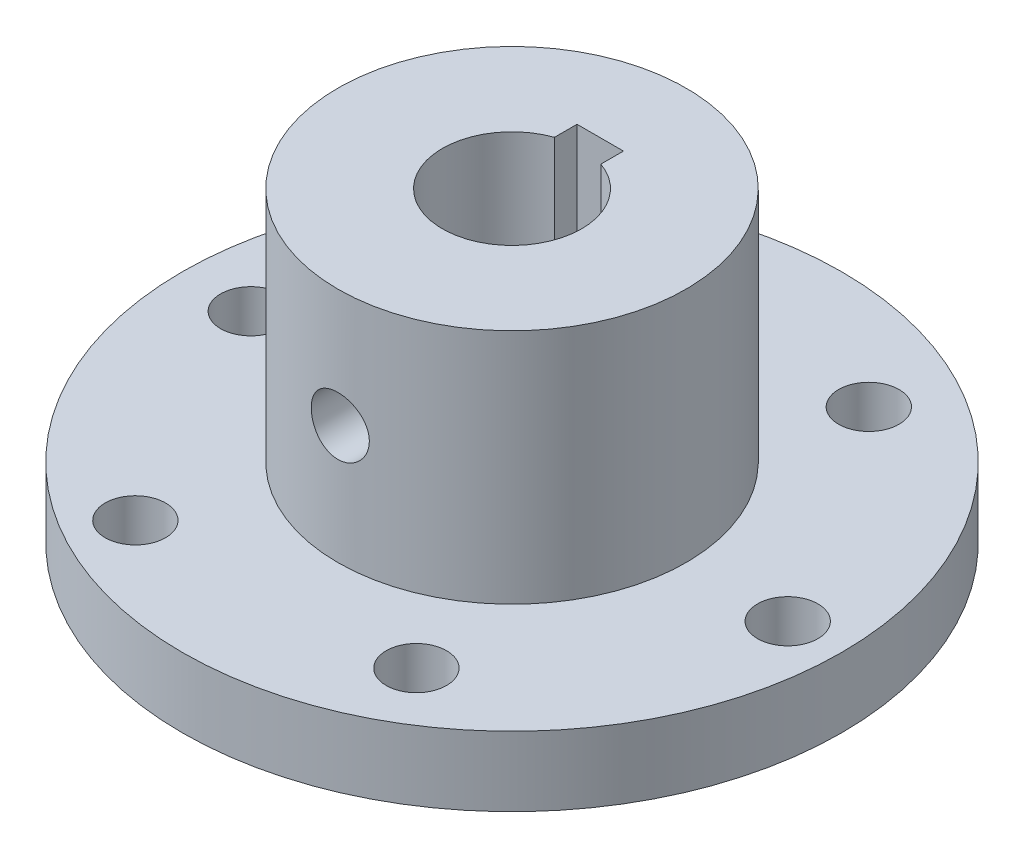
from build123d import *

# Parameters (mm, degrees)
CUT_EXTRUDE2_REACH     = 47.048
SKETCH3_R              = 2.6
CUT_EXTRUDE3_REACH     = 50.063
M6_TAPPED_HOLE2_REACH  = 56.337
M6_TAPPED_HOLE2_BORE_R = 2.5


with BuildPart() as part:
    # Sketch1 → Revolve1 (revolve)
    with BuildSketch(Plane(origin=(0, 0, 0), x_dir=(0, 0, -1), z_dir=(1, 0, 0)), mode=Mode.PRIVATE) as revolve1_sk:
        Polygon((6, 0), (28.4, 0), (28.4, 6), (15, 6), (15, 26.4), (6, 26.4), align=None)
    revolve(revolve1_sk.sketch.rotate(Axis((0, 21.767139862, 0), (0, -1, 0)), 180), axis=Axis((0, 21.767139862, 0), (0, -1, 0)))

    # Sketch3 → Cut-Extrude2 (cut, up to next)
    with BuildSketch(Plane(origin=(0, 6, 0), x_dir=(1, 0, 0), z_dir=(0, 1, 0)), mode=Mode.PRIVATE) as cut_extrude2_sk1:
        with Locations(Location((-22.5, 0, 0), (0, 0, 270))):
            Circle(SKETCH3_R)
    cut_extrude2_tool1 = extrude(cut_extrude2_sk1.sketch, amount=-CUT_EXTRUDE2_REACH, mode=Mode.PRIVATE) & part.part
    # Sketch3 → Cut-Extrude2 (cut, up to next)
    with BuildSketch(Plane(origin=(0, 6, 0), x_dir=(1, 0, 0), z_dir=(0, 1, 0)), mode=Mode.PRIVATE) as cut_extrude2_sk2:
        with Locations(Location((11.25, 19.485571585, 0), (0, 0, 270))):
            Circle(SKETCH3_R)
    cut_extrude2_tool2 = extrude(cut_extrude2_sk2.sketch, amount=-CUT_EXTRUDE2_REACH, mode=Mode.PRIVATE) & part.part
    # Sketch3 → Cut-Extrude2 (cut, up to next)
    with BuildSketch(Plane(origin=(0, 6, 0), x_dir=(1, 0, 0), z_dir=(0, 1, 0)), mode=Mode.PRIVATE) as cut_extrude2_sk3:
        with Locations(Location((11.25, -19.485571585, 0), (0, 0, 270))):
            Circle(SKETCH3_R)
    cut_extrude2_tool3 = extrude(cut_extrude2_sk3.sketch, amount=-CUT_EXTRUDE2_REACH, mode=Mode.PRIVATE) & part.part
    # Sketch3 → Cut-Extrude2 (cut, up to next)
    with BuildSketch(Plane(origin=(0, 6, 0), x_dir=(1, 0, 0), z_dir=(0, 1, 0)), mode=Mode.PRIVATE) as cut_extrude2_sk4:
        with Locations(Location((23.75, 0, 0), (0, 0, 270))):
            Circle(SKETCH3_R)
    cut_extrude2_tool4 = extrude(cut_extrude2_sk4.sketch, amount=-CUT_EXTRUDE2_REACH, mode=Mode.PRIVATE) & part.part
    # Sketch3 → Cut-Extrude2 (cut, up to next)
    with BuildSketch(Plane(origin=(0, 6, 0), x_dir=(1, 0, 0), z_dir=(0, 1, 0)), mode=Mode.PRIVATE) as cut_extrude2_sk5:
        with Locations(Location((-11.875, -20.56810334, 0), (0, 0, 270))):
            Circle(SKETCH3_R)
    cut_extrude2_tool5 = extrude(cut_extrude2_sk5.sketch, amount=-CUT_EXTRUDE2_REACH, mode=Mode.PRIVATE) & part.part
    # Sketch3 → Cut-Extrude2 (cut, up to next)
    with BuildSketch(Plane(origin=(0, 6, 0), x_dir=(1, 0, 0), z_dir=(0, 1, 0)), mode=Mode.PRIVATE) as cut_extrude2_sk6:
        with Locations(Location((-11.875, 20.56810334, 0), (0, 0, 270))):
            Circle(SKETCH3_R)
    cut_extrude2_tool6 = extrude(cut_extrude2_sk6.sketch, amount=-CUT_EXTRUDE2_REACH, mode=Mode.PRIVATE) & part.part
    add(cut_extrude2_tool1.solids().sort_by_distance((-22.5, 6, 0))[0], mode=Mode.SUBTRACT)
    add(cut_extrude2_tool2.solids().sort_by_distance((11.25, 6, -19.485572))[0], mode=Mode.SUBTRACT)
    add(cut_extrude2_tool3.solids().sort_by_distance((11.25, 6, 19.485572))[0], mode=Mode.SUBTRACT)
    add(cut_extrude2_tool4.solids().sort_by_distance((23.75, 6, 0))[0], mode=Mode.SUBTRACT)
    add(cut_extrude2_tool5.solids().sort_by_distance((-11.875, 6, 20.568103))[0], mode=Mode.SUBTRACT)
    add(cut_extrude2_tool6.solids().sort_by_distance((-11.875, 6, -20.568103))[0], mode=Mode.SUBTRACT)

    # Sketch4 → Cut-Extrude3 (cut, up to next)
    with BuildSketch(Plane(origin=(0, 26.4, 0), x_dir=(1, 0, 0), z_dir=(0, 1, 0)), mode=Mode.PRIVATE) as cut_extrude3_sk1:
        with BuildLine():
            Line((-2, 7.6), (-2, 5.656854249))
            ThreePointArc((-2, 5.656854249), (0, 6), (2, 5.656854249))
            Line((2, 5.656854249), (2, 7.6))
            Line((2, 7.6), (-2, 7.6))
        make_face()
    cut_extrude3_tool1 = extrude(cut_extrude3_sk1.sketch, amount=-CUT_EXTRUDE3_REACH, mode=Mode.PRIVATE) & part.part
    add(cut_extrude3_tool1.solids().sort_by_distance((0, 26.4, -6.740451))[0], mode=Mode.SUBTRACT)

    # M6 Tapped Hole2 bore (on position points) → M6 Tapped Hole2 (cut, up to next)
    with BuildSketch(Plane(origin=(0, 16.2, 15), x_dir=(1, 0, 0), z_dir=(0, 0, 1)), mode=Mode.PRIVATE) as m6_tapped_hole2_sk1:
        Circle(M6_TAPPED_HOLE2_BORE_R)
    m6_tapped_hole2_tool1 = extrude(m6_tapped_hole2_sk1.sketch, amount=-M6_TAPPED_HOLE2_REACH, mode=Mode.PRIVATE) & part.part
    add(m6_tapped_hole2_tool1.solids().sort_by_distance((0, 16.2, 15))[0], mode=Mode.SUBTRACT)


solid = part.part
